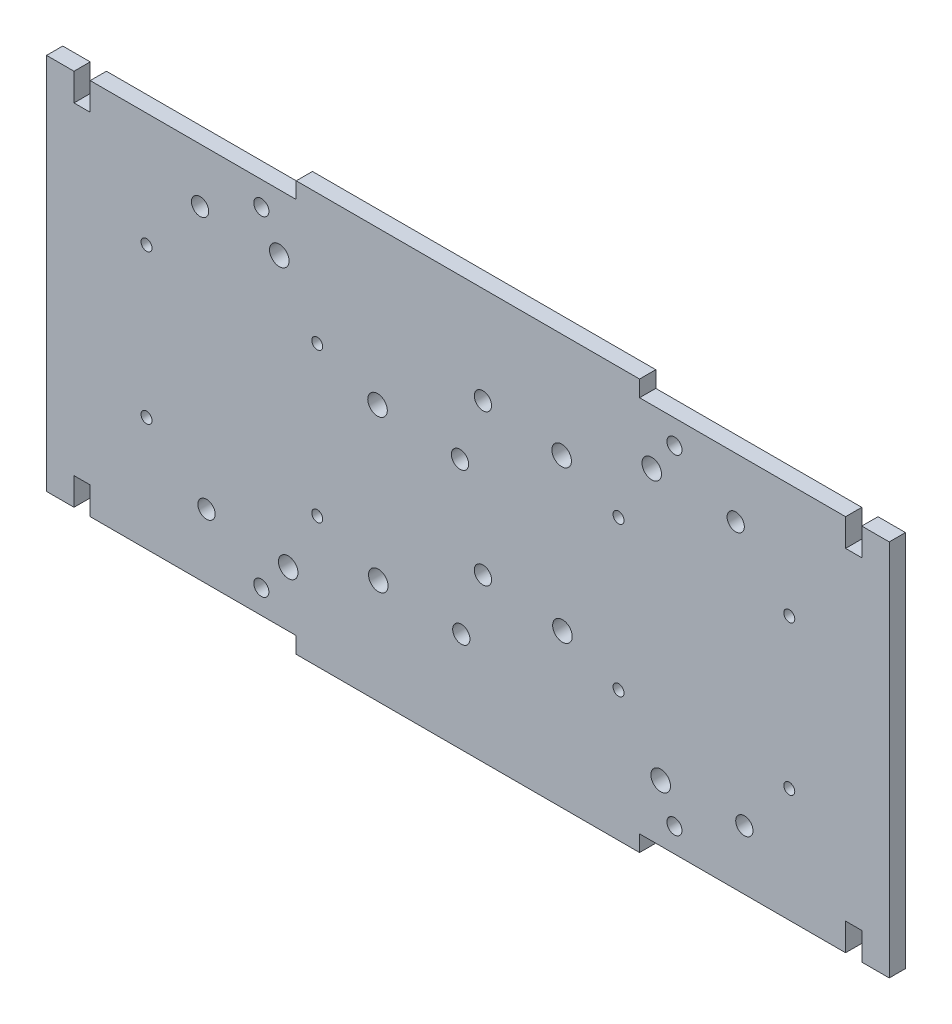
from build123d import *

# Parameters (mm, degrees)
BOSS_EXTRUDE1_DEPTH = 2.9972
SKETCH9_R           = 1.397
CUT_EXTRUDE3_DEPTH  = 165.784096913
SKETCH10_R          = 1.80975
CUT_EXTRUDE4_DEPTH  = 165.784096913
SKETCH11_R          = 1.6
CUT_EXTRUDE5_DEPTH  = 165.784096913
SKETCH12_R          = 1.016
CUT_EXTRUDE6_DEPTH  = 165.784096913


with BuildPart() as part:
    # Sketch3 → Boss-Extrude1 (new body)
    with BuildSketch(Plane.XY):
        Polygon((38.1, 0), (38.1, -2.9972), (101.6, -2.9972), (101.6, 0), (139.7, 0), (139.7, 5.08), (142.6972, 5.08), (142.6972, 0), (147.7772, 0), (147.7772, 69.85), (142.6972, 69.85), (142.6972, 64.77), (139.7, 64.77), (139.7, 69.85), (101.6, 69.85), (101.6, 72.8472), (38.1, 72.8472), (38.1, 69.85), (0, 69.85), (0, 64.77), (-2.9972, 64.77), (-2.9972, 69.85), (-8.0772, 69.85), (-8.0772, 0), (-2.9972, 0), (-2.9972, 5.08), (0, 5.08), (0, 0), align=None)
    extrude(amount=BOSS_EXTRUDE1_DEPTH)

    # Sketch9 → Cut-Extrude3 (cut, through all)
    with BuildSketch(Plane(origin=(0, 0, 0), x_dir=(-1, 0, 0), z_dir=(0, 0, -1))):
        with Locations((-31.6484, 4.445)):
            Circle(SKETCH9_R)
        with Locations((-108.0516, 65.405)):
            Circle(SKETCH9_R)
        with Locations((-108.0516, 4.445)):
            Circle(SKETCH9_R)
        with Locations((-31.6484, 65.405)):
            Circle(SKETCH9_R)
    extrude(amount=-CUT_EXTRUDE3_DEPTH, mode=Mode.SUBTRACT)

    # Sketch10 → Cut-Extrude4 (cut, through all)
    with BuildSketch(Plane(origin=(0, 0, 0), x_dir=(-1, 0, 0), z_dir=(0, 0, -1))):
        with Locations((-53.1368, 44.48175)):
            Circle(SKETCH10_R)
        with Locations((-34.967367815, 59.34075)):
            Circle(SKETCH10_R)
        with Locations((-87.189767815, 53.40985)):
            Circle(SKETCH10_R)
        with Locations((-103.85425, 59.63285)):
            Circle(SKETCH10_R)
        with Locations((-87.335817815, 25.36825)):
            Circle(SKETCH10_R)
        with Locations((-105.50525, 10.50925)):
            Circle(SKETCH10_R)
        with Locations((-53.28285, 16.44015)):
            Circle(SKETCH10_R)
        with Locations((-36.618367815, 10.21715)):
            Circle(SKETCH10_R)
    extrude(amount=-CUT_EXTRUDE4_DEPTH, mode=Mode.SUBTRACT)

    # Sketch11 → Cut-Extrude5 (cut, through all)
    with BuildSketch(Plane(origin=(0, 0, 0), x_dir=(-1, 0, 0), z_dir=(0, 0, -1))):
        with Locations((-119.38, 58.864027758)):
            Circle(SKETCH11_R)
        with Locations((-120.98, 10.985972242)):
            Circle(SKETCH11_R)
        with Locations((-68.629534614, 15.487902261)):
            Circle(SKETCH11_R)
        with Locations((-68.390649314, 43.386879551)):
            Circle(SKETCH11_R)
        with Locations((-21.50999995, 11.950503851)):
            Circle(SKETCH11_R)
        with Locations((-20.32, 59.840503852)):
            Circle(SKETCH11_R)
        with Locations((-72.629999995, 54.890503798)):
            Circle(SKETCH11_R)
        with Locations((-72.629999966, 26.990503798)):
            Circle(SKETCH11_R)
    extrude(amount=-CUT_EXTRUDE5_DEPTH, mode=Mode.SUBTRACT)

    # Sketch12 → Cut-Extrude6 (cut, through all)
    with BuildSketch(Plane.XY.offset(2.9972)):
        with Locations((10.414, 21.1074)):
            Circle(SKETCH12_R)
        with Locations((10.414, 48.7426)):
            Circle(SKETCH12_R)
        with Locations((41.9862, 21.1074)):
            Circle(SKETCH12_R)
        with Locations((41.9862, 48.7426)):
            Circle(SKETCH12_R)
        with Locations(Location((129.286, 21.1074, 0), (0, 0, 180))):
            Circle(SKETCH12_R)
        with Locations(Location((129.286, 48.7426, 0), (0, 0, 180))):
            Circle(SKETCH12_R)
        with Locations(Location((97.7138, 21.1074, 0), (0, 0, 180))):
            Circle(SKETCH12_R)
        with Locations(Location((97.7138, 48.7426, 0), (0, 0, 180))):
            Circle(SKETCH12_R)
    extrude(amount=-CUT_EXTRUDE6_DEPTH, mode=Mode.SUBTRACT)


solid = part.part
